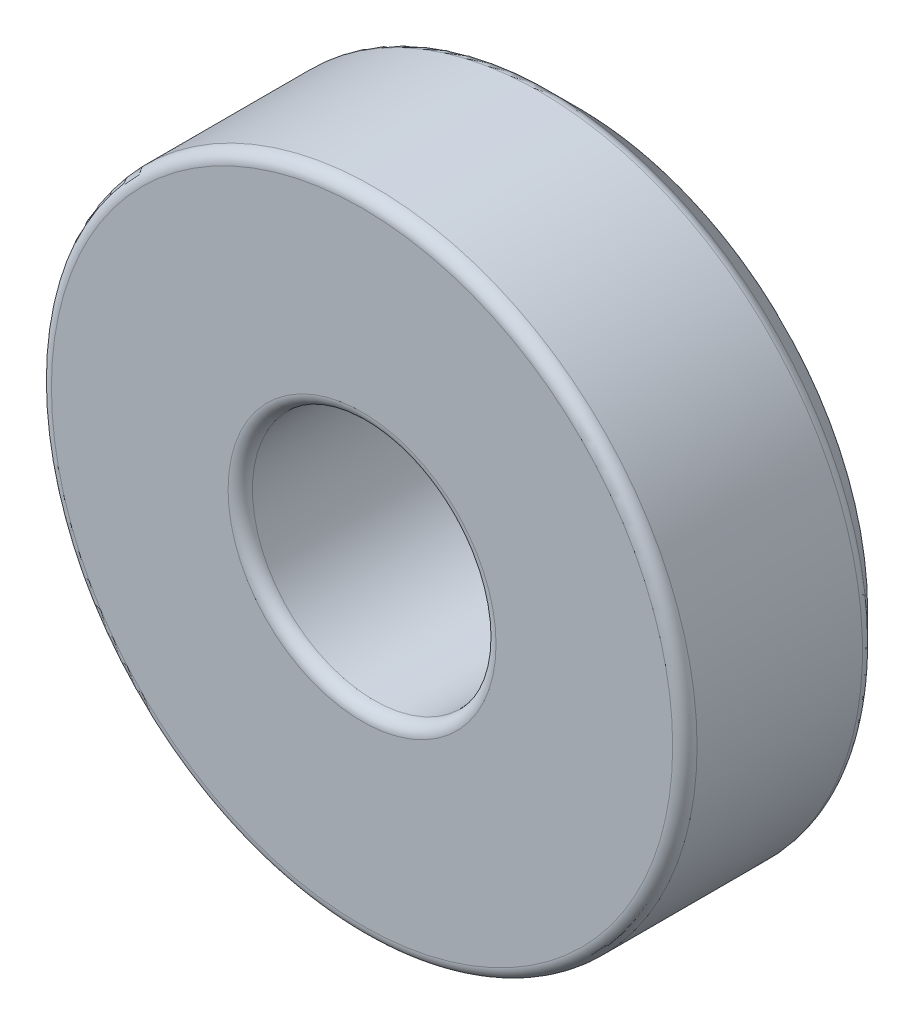
from build123d import *

# Parameters (mm, degrees)
SKETCH1_R           = 1.325
SKETCH1_R_2         = 0.5
BOSS_EXTRUDE1_DEPTH = 0.9
CHAMFER1_SIZE       = 0.15
FILLET1_R           = 0.05


with BuildPart() as part:
    # Sketch1 → Boss-Extrude1 (new body)
    with BuildSketch(Plane.XY):
        Circle(SKETCH1_R)
        Circle(SKETCH1_R_2, mode=Mode.SUBTRACT)
    extrude(amount=BOSS_EXTRUDE1_DEPTH)

    # Chamfer1
    chamfer1_edges = [part.edges().sort_by_distance(p)[0] for p in [
        (-1.325, 0, 0),
    ]]
    chamfer(chamfer1_edges, length=CHAMFER1_SIZE)

    # Fillet1
    fillet1_edges = [part.edges().sort_by_distance(p)[0] for p in [
        (-1.175, 0, 0),
        (-1.325, 0, 0.9),
        (-0.5, 0, 0),
        (-0.5, 0, 0.9),
        (-1.325, 0, 0.15),
    ]]
    fillet(fillet1_edges, radius=FILLET1_R)


solid = part.part
